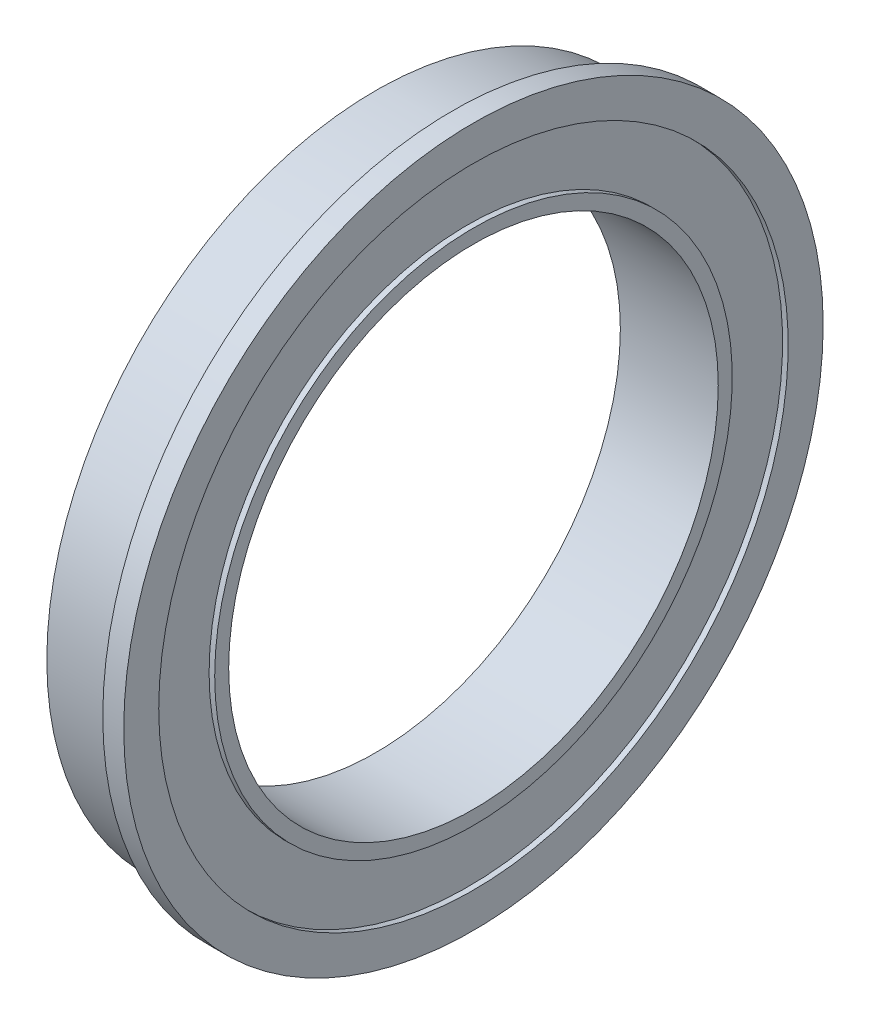
from build123d import *


with BuildPart() as part:
    # 草图1 → 旋转1 (revolve)
    with BuildSketch(Plane.XY, mode=Mode.PRIVATE) as revolve_1_sk:
        Polygon((5.5, 25), (7, 25), (7, 22.5), (6.6, 22.5), (6.6, 18.5), (7, 18.5), (7, 17.5), (0, 17.5), (0, 18.5), (0.4, 18.5), (0.4, 22.5), (0, 22.5), (0, 23.5), (5.5, 23.5), align=None)
    revolve(revolve_1_sk.sketch.rotate(Axis((0, 0, 0), (1, 0, 0)), 90), axis=Axis((0, 0, 0), (1, 0, 0)))


solid = part.part
